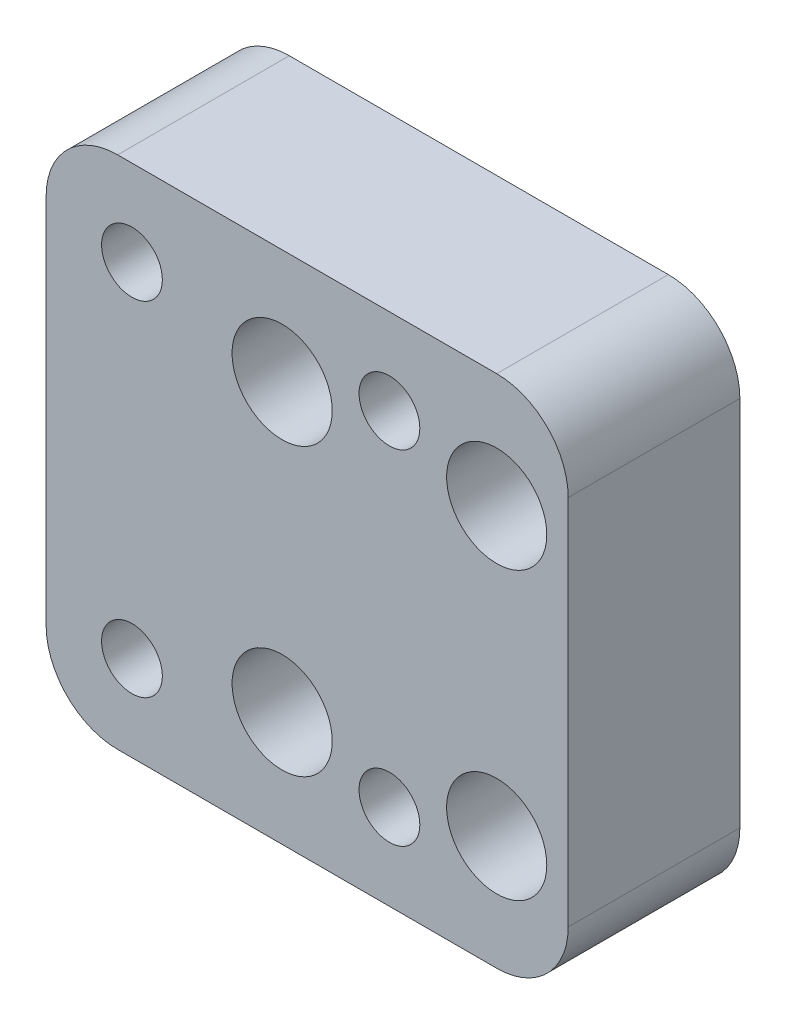
from build123d import *

# Parameters (mm, degrees)
SKETCH1_W           = 36.5
SKETCH1_H           = 36
SKETCH1_R           = 1.625
SKETCH1_R_2         = 2.125
BOSS_EXTRUDE1_DEPTH = 12
SKETCH2_R           = 3.5
CUT_EXTRUDE1_DEPTH  = 8
CUT_EXTRUDE2_DEPTH  = 8
FILLET2_R           = 5


with BuildPart() as part:
    # Sketch1 → Boss-Extrude1 (new body)
    with BuildSketch(Plane.XY):
        with Locations((1.75, 10)):
            Rectangle(SKETCH1_W, SKETCH1_H)
        with Locations((0, 20)):
            Circle(SKETCH1_R, mode=Mode.SUBTRACT)
        with Locations((15, 20)):
            Circle(SKETCH1_R, mode=Mode.SUBTRACT)
        with Locations((15, 0)):
            Circle(SKETCH1_R, mode=Mode.SUBTRACT)
        Circle(SKETCH1_R, mode=Mode.SUBTRACT)
        with Locations((-10.5, 22)):
            Circle(SKETCH1_R_2, mode=Mode.SUBTRACT)
        with Locations((7.5, 22)):
            Circle(SKETCH1_R_2, mode=Mode.SUBTRACT)
        with Locations((7.5, -2)):
            Circle(SKETCH1_R_2, mode=Mode.SUBTRACT)
        with Locations((-10.5, -2)):
            Circle(SKETCH1_R_2, mode=Mode.SUBTRACT)
    extrude(amount=BOSS_EXTRUDE1_DEPTH)

    # Sketch2 → Cut-Extrude1 (cut)
    with BuildSketch(Plane.XY.offset(12)):
        with Locations((0, 20)):
            Circle(SKETCH2_R)
        Circle(SKETCH2_R)
        with Locations((15, 0)):
            Circle(SKETCH2_R)
        with Locations((15, 20)):
            Circle(SKETCH2_R)
    extrude(amount=-CUT_EXTRUDE1_DEPTH, mode=Mode.SUBTRACT)

    # Sketch3 → Cut-Extrude2 (cut)
    with BuildSketch(Plane(origin=(0, 0, 0), x_dir=(-1, 0, 0), z_dir=(0, 0, -1))):
        Polygon((-5.334936491, 18.25), (-3.169872981, 22), (-5.334936491, 25.75), (-9.665063509, 25.75), (-11.830127019, 22), (-9.665063509, 18.25), align=None)
        Polygon((12.665063509, 18.25), (14.830127019, 22), (12.665063509, 25.75), (8.334936491, 25.75), (6.169872981, 22), (8.334936491, 18.25), align=None)
        Polygon((12.665063509, -5.75), (14.830127019, -2), (12.665063509, 1.75), (8.334936491, 1.75), (6.169872981, -2), (8.334936491, -5.75), align=None)
        Polygon((-9.665063509, -5.75), (-5.334936491, -5.75), (-3.169872981, -2), (-5.334936491, 1.75), (-9.665063509, 1.75), (-11.830127019, -2), align=None)
    extrude(amount=-CUT_EXTRUDE2_DEPTH, mode=Mode.SUBTRACT)

    # Fillet2
    fillet2_edges = [part.edges().sort_by_distance(p)[0] for p in [
        (-16.5, 28, 6),
        (20, 28, 6),
        (20, -8, 6),
        (-16.5, -8, 6),
    ]]
    fillet(fillet2_edges, radius=FILLET2_R)


solid = part.part
